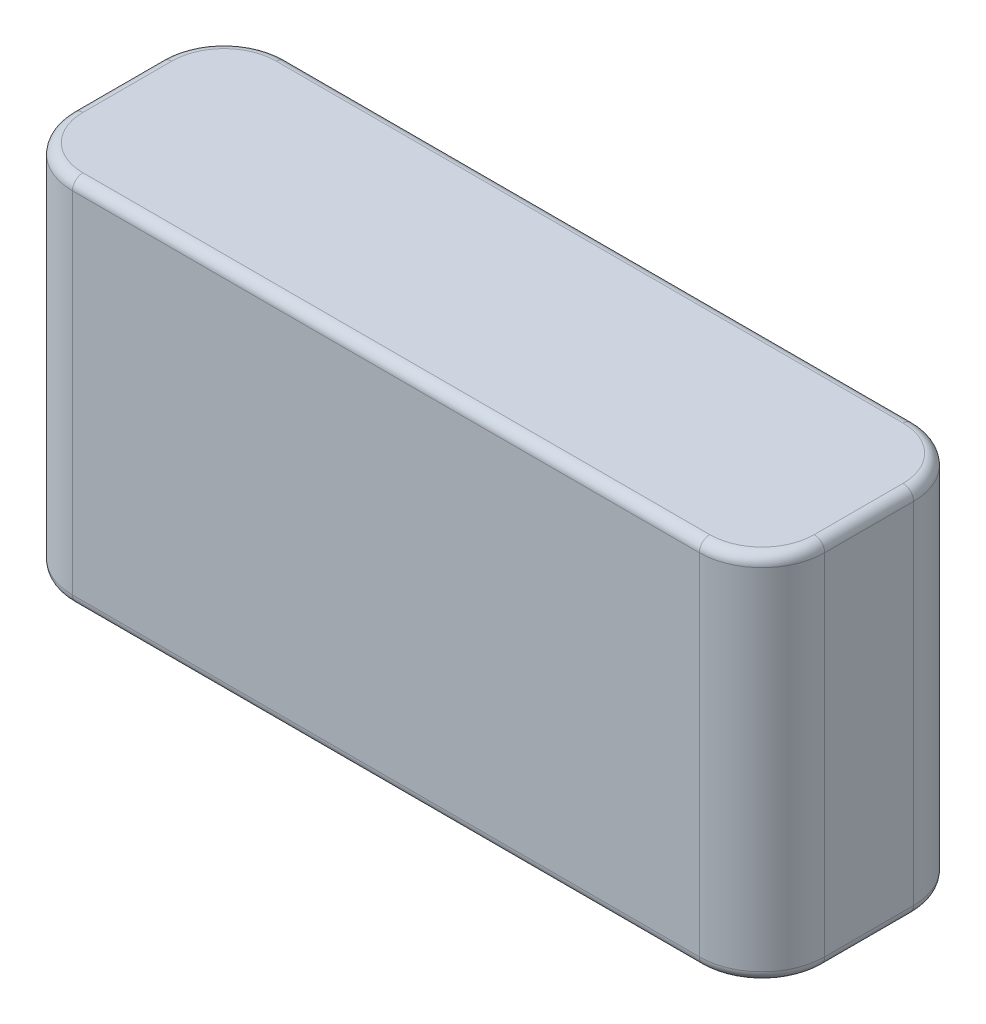
from build123d import *

# Parameters (mm, degrees)
SKETCH_1_W      = 72
SKETCH_1_H      = 35.5
EXTRUDE_1_DEPTH = 20.5
FILLET_1_R      = 6
FILLET_2_R      = 1


with BuildPart() as part:
    # 草图1 → 凸台-拉伸1 (new body)
    with BuildSketch(Plane.XY):
        Rectangle(SKETCH_1_W, SKETCH_1_H)
    extrude(amount=EXTRUDE_1_DEPTH)

    # 圆角1
    fillet_1_edges = [part.edges().sort_by_distance(p)[0] for p in [
        (-36, 0, 20.5),
        (36, 0, 20.5),
        (-36, 0, 0),
        (36, 0, 0),
    ]]
    fillet(fillet_1_edges, radius=FILLET_1_R)

    # 圆角2
    fillet_2_edges = [part.edges().sort_by_distance(p)[0] for p in [
        (-36, -17.75, 10.25),
        (-36, 17.75, 10.25),
        (0, -17.75, 0),
        (36, -17.75, 10.25),
        (0, -17.75, 20.5),
        (34.242640687, -17.75, 18.742640687),
        (34.242640687, -17.75, 1.757359313),
        (-34.242640687, -17.75, 18.742640687),
        (-34.242640687, -17.75, 1.757359313),
        (0, 17.75, 0),
        (0, 17.75, 20.5),
        (36, 17.75, 10.25),
        (34.242640687, 17.75, 18.742640687),
        (34.242640687, 17.75, 1.757359313),
        (-34.242640687, 17.75, 18.742640687),
        (-34.242640687, 17.75, 1.757359313),
    ]]
    fillet(fillet_2_edges, radius=FILLET_2_R)


solid = part.part
